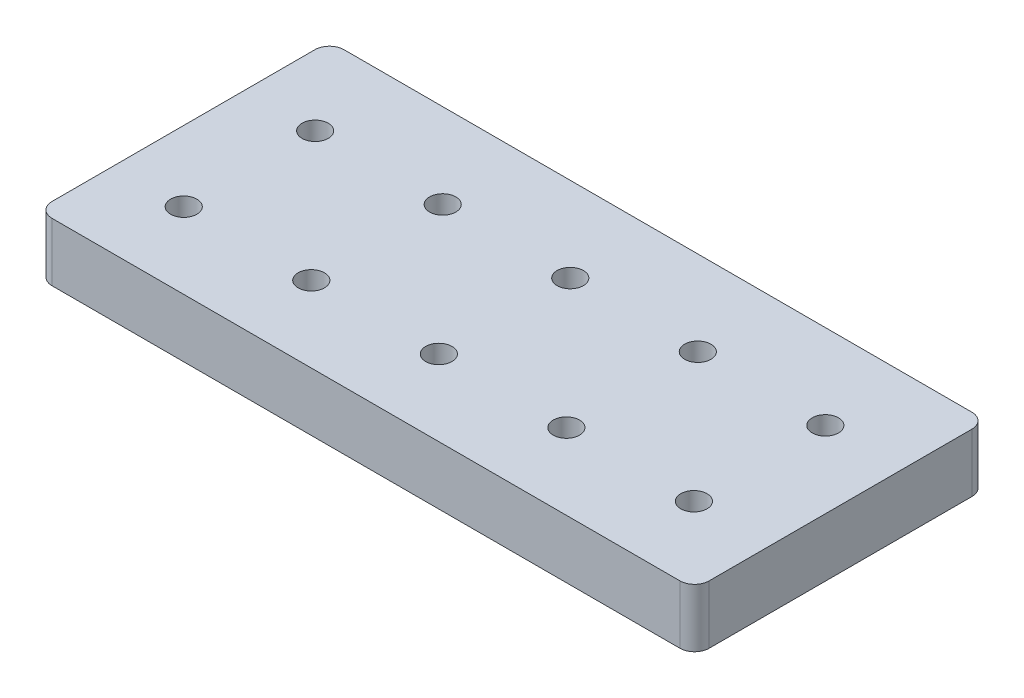
from build123d import *

# Parameters (mm, degrees)
BOSS_EXTRUDE1_DEPTH = 50.8
SKETCH2_R           = 50.8
CUT_EXTRUDE1_DEPTH  = 10.16
SKETCH3_R           = 11.43
CUT_EXTRUDE2_DEPTH  = 627.721516784


with BuildPart() as part:
    # Sketch1 → Boss-Extrude1 (new body)
    with BuildSketch(Plane(origin=(0, 0, 0), x_dir=(1, 0, 0), z_dir=(0, 1, 0))):
        with BuildLine():
            Line((-12.7, 0), (-558.8, 0))
            ThreePointArc((-558.8, 0), (-567.780256121, 3.719743879), (-571.5, 12.7))
            Line((-571.5, 12.7), (-571.5, 241.3))
            ThreePointArc((-571.5, 241.3), (-567.780256121, 250.280256121), (-558.8, 254))
            Line((-558.8, 254), (-12.7, 254))
            ThreePointArc((-12.7, 254), (-3.719743879, 250.280256121), (0, 241.3))
            Line((0, 241.3), (0, 12.7))
            ThreePointArc((0, 12.7), (-3.719743879, 3.719743879), (-12.7, 0))
        make_face()
    extrude(amount=BOSS_EXTRUDE1_DEPTH)

    # Sketch2 → Cut-Extrude1 (cut)
    with BuildSketch(Plane(origin=(0, 0, 0), x_dir=(1, 0, 0), z_dir=(0, 1, 0))):
        with Locations(Location((-177.499611663, 66.04, 0), (0, 0, 270))):
            Circle(SKETCH2_R)
        with Locations(Location((-66.57081555, 66.04, 0), (0, 0, 270))):
            Circle(SKETCH2_R)
        with Locations(Location((-288.428407775, 66.04, 0), (0, 0, 270))):
            Circle(SKETCH2_R)
        with Locations(Location((-399.357203888, 66.04, 0), (0, 0, 270))):
            Circle(SKETCH2_R)
        with Locations(Location((-510.286, 66.04, 0), (0, 0, 270))):
            Circle(SKETCH2_R)
        with Locations(Location((-177.499611663, 180.34, 0), (0, 0, 270))):
            Circle(SKETCH2_R)
        with Locations(Location((-288.428407775, 180.34, 0), (0, 0, 270))):
            Circle(SKETCH2_R)
        with Locations(Location((-399.357203888, 180.34, 0), (0, 0, 270))):
            Circle(SKETCH2_R)
        with Locations(Location((-510.286, 180.34, 0), (0, 0, 270))):
            Circle(SKETCH2_R)
        with Locations(Location((-66.57081555, 180.34, 0), (0, 0, 270))):
            Circle(SKETCH2_R)
    extrude(amount=CUT_EXTRUDE1_DEPTH, mode=Mode.SUBTRACT)

    # Sketch3 → Cut-Extrude2 (cut, through all)
    with BuildSketch(Plane.XZ.offset(-10.16)):
        with Locations(Location((-66.57081555, -180.34, 0), (0, 0, 270))):
            Circle(SKETCH3_R)
        with Locations(Location((-177.499611663, -180.34, 0), (0, 0, 270))):
            Circle(SKETCH3_R)
        with Locations(Location((-288.428407775, -180.34, 0), (0, 0, 270))):
            Circle(SKETCH3_R)
        with Locations(Location((-399.357203888, -180.34, 0), (0, 0, 270))):
            Circle(SKETCH3_R)
        with Locations(Location((-510.286, -180.34, 0), (0, 0, 270))):
            Circle(SKETCH3_R)
        with Locations(Location((-510.286, -66.04, 0), (0, 0, 90))):
            Circle(SKETCH3_R)
        with Locations(Location((-399.357203888, -66.04, 0), (0, 0, 90))):
            Circle(SKETCH3_R)
        with Locations(Location((-288.428407775, -66.04, 0), (0, 0, 90))):
            Circle(SKETCH3_R)
        with Locations(Location((-177.499611663, -66.04, 0), (0, 0, 90))):
            Circle(SKETCH3_R)
        with Locations(Location((-66.57081555, -66.04, 0), (0, 0, 90))):
            Circle(SKETCH3_R)
    extrude(amount=-CUT_EXTRUDE2_DEPTH, mode=Mode.SUBTRACT)


solid = part.part
